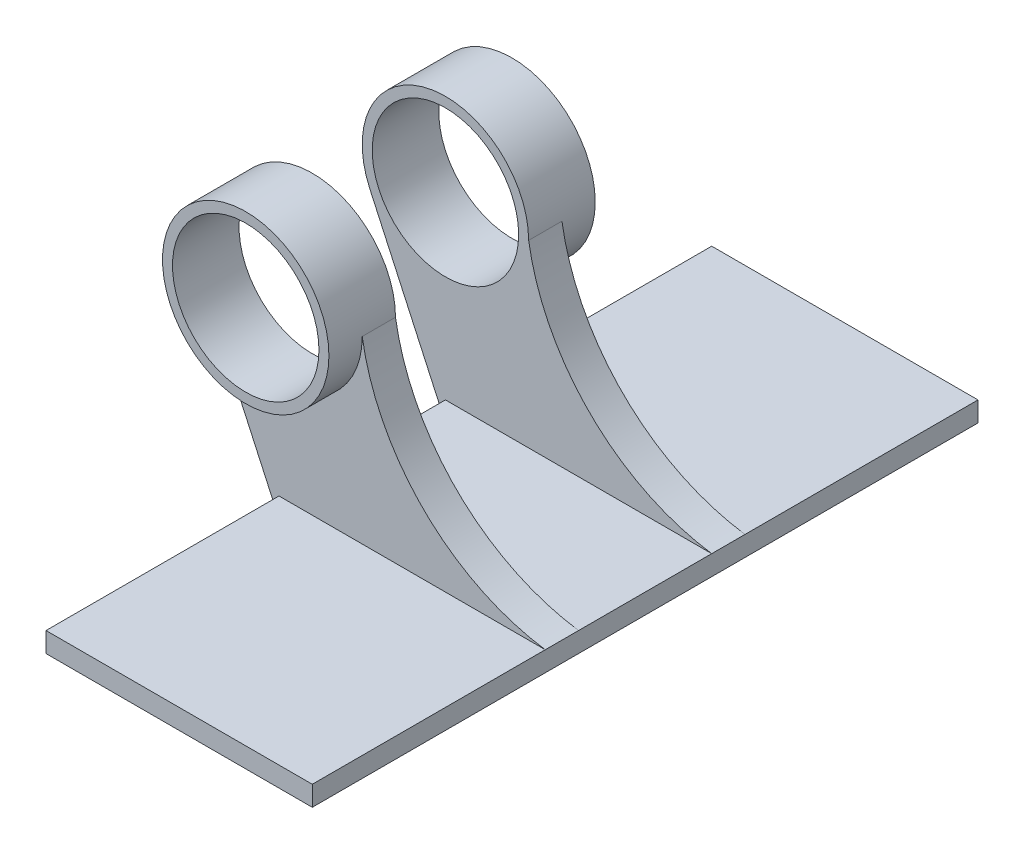
from build123d import *

# Parameters (mm, degrees)
CROQUIS2_R              = 12.5
CROQUIS2_R_2            = 11
SALIENTE_EXTRUIR1_DEPTH = 10
SALIENTE_EXTRUIR2_DEPTH = 5
CROQUIS2_6_W            = 40
CROQUIS2_6_H            = 3
SALIENTE_EXTRUIR3_DEPTH = 40
CROQUIS2_7_W            = 40
CROQUIS2_7_H            = 3
SALIENTE_EXTRUIR4_DEPTH = 20


with BuildPart() as part:
    # Croquis2 → Saliente-Extruir1 (new body)
    with BuildSketch(Plane.XY):
        Circle(CROQUIS2_R)
        Circle(CROQUIS2_R_2, mode=Mode.SUBTRACT)
    extrude(amount=SALIENTE_EXTRUIR1_DEPTH)

    # Croquis2<4> → Saliente-Extruir2 (add)
    with BuildSketch(Plane.XY):
        with BuildLine():
            Line((-11.363241786, -5.208333333), (0, -30))
            Line((0, -30), (0, -27))
            Line((0, -27), (40, -27))
            ThreePointArc((40, -27), (21.826404492, -18.005513943), (12.5, 0))
            ThreePointArc((12.5, 0), (2.665471597, -12.212504295), (-11.363241786, -5.208333333))
        make_face()
    extrude(amount=SALIENTE_EXTRUIR2_DEPTH)

    # Croquis2<6> → Saliente-Extruir3 (add)
    with BuildSketch(Plane.XY):
        with Locations((20, -28.5)):
            Rectangle(CROQUIS2_6_W, CROQUIS2_6_H)
    extrude(amount=SALIENTE_EXTRUIR3_DEPTH)


with BuildPart() as body_2:
    # Simetría2: mirrored copy
    add(part.part.mirror(Plane(origin=(0, 0, -10), x_dir=(1, 0, 0), z_dir=(0, 0, -1))))


with BuildPart() as part_1:
    add(part.part)

    add(body_2.part)  # Saliente-Extruir4 merges body 2
    # Croquis2<7> → Saliente-Extruir4 (add)
    with BuildSketch(Plane.XY):
        with Locations((20, -28.5)):
            Rectangle(CROQUIS2_7_W, CROQUIS2_7_H)
    extrude(amount=-SALIENTE_EXTRUIR4_DEPTH)


solid = part_1.part
